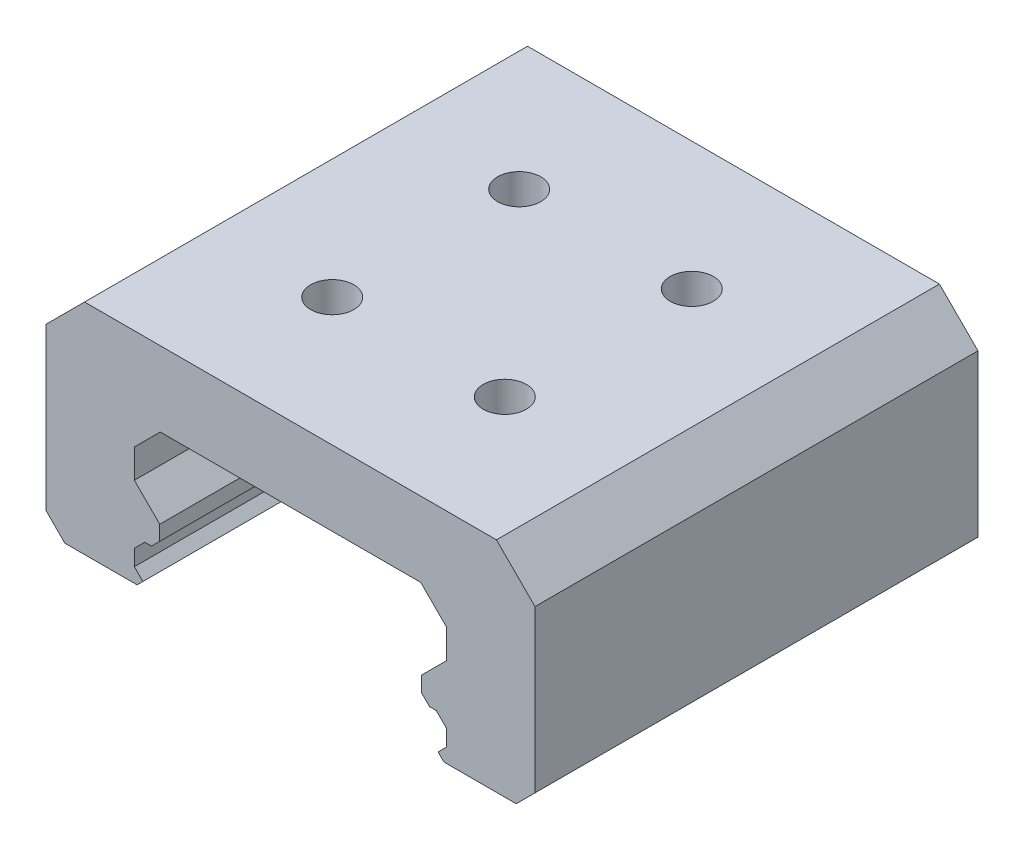
from build123d import *

# Parameters (mm, degrees)
BOSS_EXTRUDE1_DEPTH = 30.8
SKETCH2_R           = 1.5
CUT_EXTRUDE1_DEPTH  = 3


with BuildPart() as part:
    # Sketch1 → Boss-Extrude1 (new body)
    with BuildSketch(Plane.XY):
        Polygon((-9.054919228, 5.785059654), (9.054919228, 5.785059654), (10.856146045, 3.983832837), (10.856146045, 1.977204652), (9.091867013, 0.21292562), (9.091867013, -0.817284255), (9.66657341, -1.391990652), (10.13460575, -1.391990652), (10.856146045, -2.113530947), (10.856146045, -3.22536771), (10.261359727, -3.820154028), (10.666709383, -4.225503683), (15.692371673, -4.225503683), (17, -2.917875356), (17, 8.301296502), (14.320116844, 10.981179658), (-14.320116844, 10.981179658), (-17, 8.301296502), (-17, -2.917875356), (-15.692371673, -4.225503683), (-10.666709383, -4.225503683), (-10.261359727, -3.820154028), (-10.856146045, -3.22536771), (-10.856146045, -2.113530947), (-10.13460575, -1.391990652), (-9.66657341, -1.391990652), (-9.091867013, -0.817284255), (-9.091867013, 0.21292562), (-10.856146045, 1.977204652), (-10.856146045, 3.983832837), align=None)
    extrude(amount=BOSS_EXTRUDE1_DEPTH)

    # Sketch2 → Cut-Extrude1 (cut)
    with BuildSketch(Plane(origin=(0, 10.981179658, 0), x_dir=(1, 0, 0), z_dir=(0, 1, 0))):
        with Locations(Location((-6, -8.9, 0), (0, 0, 270))):
            Circle(SKETCH2_R)
        with Locations(Location((6, -8.9, 0), (0, 0, 90))):
            Circle(SKETCH2_R)
        with Locations(Location((6, -21.9, 0), (0, 0, 270))):
            Circle(SKETCH2_R)
        with Locations(Location((-6, -21.9, 0), (0, 0, 90))):
            Circle(SKETCH2_R)
    extrude(amount=-CUT_EXTRUDE1_DEPTH, mode=Mode.SUBTRACT)


solid = part.part
